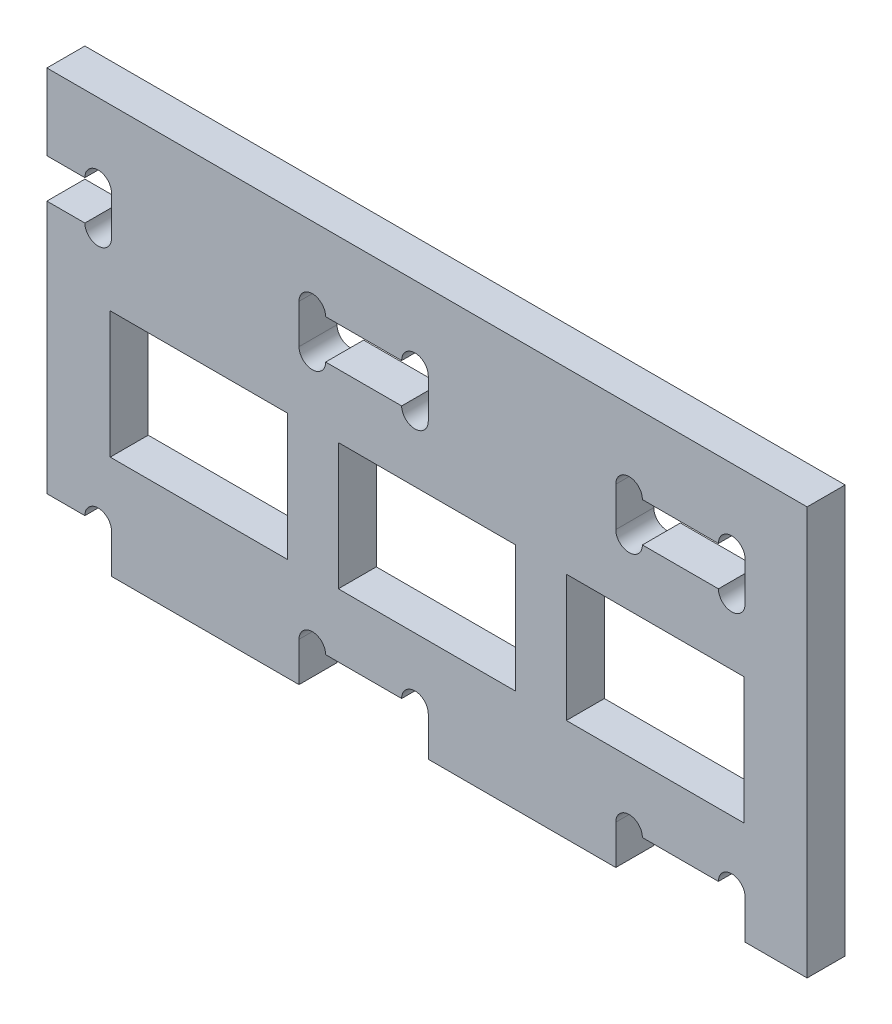
from build123d import *

# Parameters (mm, degrees)
SKETCH_1_W          = 14
SKETCH_1_H          = 10
EXTRUDE_1_DEPTH     = 3
SKETCH_2_W          = 10
SKETCH_2_H          = 32.2
CUT_EXTRUDE_1_DEPTH = 10


with BuildPart() as part:
    # 草图1 → 凸台-拉伸1 (new body)
    with BuildSketch(Plane.XY):
        with BuildLine():
            Line((-19.9, -16.1), (-5.1, -16.1))
            Line((-5.1, -16.1), (-5.1, -13))
            ThreePointArc((-5.1, -13), (-4.05, -11.95), (-3, -13))
            Line((-3, -13), (3, -13))
            ThreePointArc((3, -13), (4.05, -11.95), (5.1, -13))
            Line((5.1, -13), (5.1, -16.1))
            Line((5.1, -16.1), (19.9, -16.1))
            Line((19.9, -16.1), (19.9, -13))
            ThreePointArc((19.9, -13), (20.95, -11.95), (22, -13))
            Line((22, -13), (28, -13))
            ThreePointArc((28, -13), (29.05, -11.95), (30.1, -13))
            Line((30.1, -13), (30.1, -16.1))
            Line((30.1, -16.1), (35, -16.1))
            Line((35, -16.1), (35, 16.1))
            Line((35, 16.1), (-35, 16.1))
            Line((-35, 16.1), (-35, -16.1))
            Line((-35, -16.1), (-30.1, -16.1))
            Line((-30.1, -16.1), (-30.1, -13))
            ThreePointArc((-30.1, -13), (-29.05, -11.95), (-28, -13))
            Line((-28, -13), (-22, -13))
            ThreePointArc((-22, -13), (-20.95, -11.95), (-19.9, -13))
            Line((-19.9, -13), (-19.9, -16.1))
        make_face()
        with Locations((-13, -3)):
            Rectangle(SKETCH_1_W, SKETCH_1_H, mode=Mode.SUBTRACT)
        with Locations((5, -3)):
            Rectangle(SKETCH_1_W, SKETCH_1_H, mode=Mode.SUBTRACT)
        with Locations((23, -3)):
            Rectangle(SKETCH_1_W, SKETCH_1_H, mode=Mode.SUBTRACT)
        with BuildLine():
            Line((-22, 7), (-28, 7))
            ThreePointArc((-28, 7), (-29.05, 5.95), (-30.1, 7))
            Line((-30.1, 7), (-30.1, 10.1))
            ThreePointArc((-30.1, 10.1), (-29.05, 11.15), (-28, 10.1))
            Line((-28, 10.1), (-22, 10.1))
            ThreePointArc((-22, 10.1), (-20.95, 11.15), (-19.9, 10.1))
            Line((-19.9, 10.1), (-19.9, 7))
            ThreePointArc((-19.9, 7), (-20.95, 5.95), (-22, 7))
        make_face(mode=Mode.SUBTRACT)
        with BuildLine():
            Line((3, 7), (-3, 7))
            ThreePointArc((-3, 7), (-4.05, 5.95), (-5.1, 7))
            Line((-5.1, 7), (-5.1, 10.1))
            ThreePointArc((-5.1, 10.1), (-4.05, 11.15), (-3, 10.1))
            Line((-3, 10.1), (3, 10.1))
            ThreePointArc((3, 10.1), (4.05, 11.15), (5.1, 10.1))
            Line((5.1, 10.1), (5.1, 7))
            ThreePointArc((5.1, 7), (4.05, 5.95), (3, 7))
        make_face(mode=Mode.SUBTRACT)
        with BuildLine():
            Line((30.1, 10.1), (30.1, 7))
            ThreePointArc((30.1, 7), (29.05, 5.95), (28, 7))
            Line((28, 7), (22, 7))
            ThreePointArc((22, 7), (20.95, 5.95), (19.9, 7))
            Line((19.9, 7), (19.9, 10.1))
            ThreePointArc((19.9, 10.1), (20.95, 11.15), (22, 10.1))
            Line((22, 10.1), (28, 10.1))
            ThreePointArc((28, 10.1), (29.05, 11.15), (30.1, 10.1))
        make_face(mode=Mode.SUBTRACT)
    extrude(amount=EXTRUDE_1_DEPTH)

    # 草图2 → 切除-拉伸1 (cut)
    with BuildSketch(Plane.XY.offset(3)):
        with Locations((-30, 0)):
            Rectangle(SKETCH_2_W, SKETCH_2_H)
    extrude(amount=-CUT_EXTRUDE_1_DEPTH, mode=Mode.SUBTRACT)


solid = part.part
